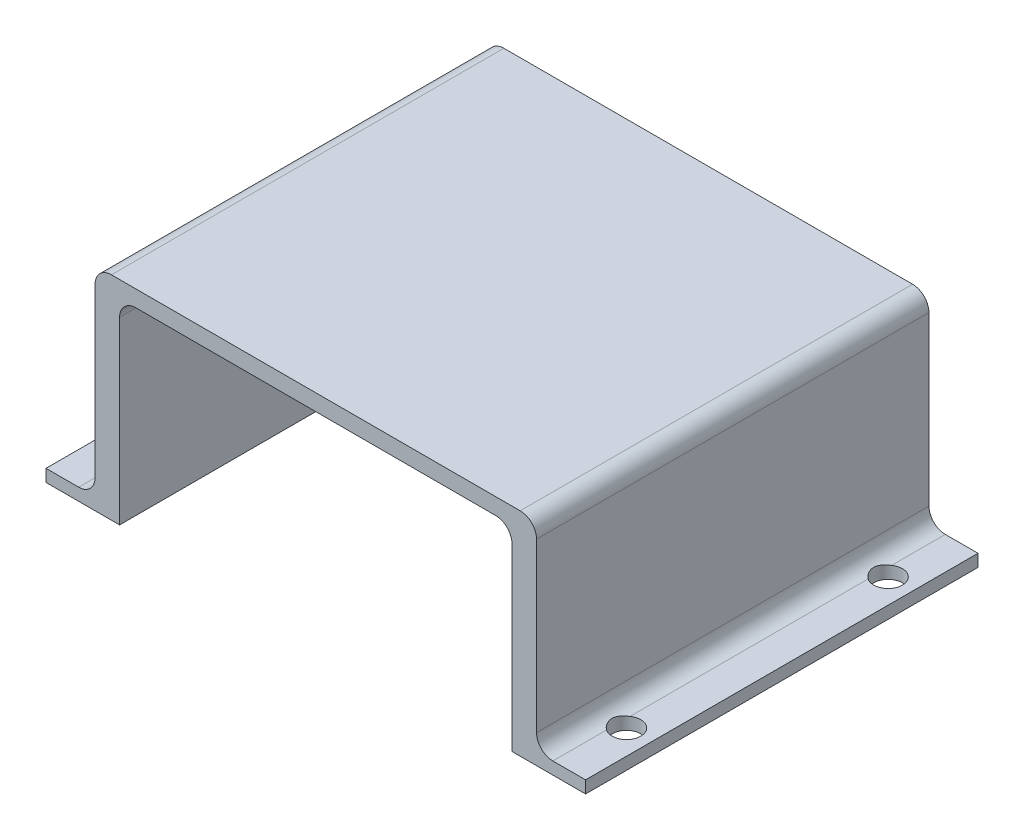
from build123d import *

# Parameters (mm, degrees)
BOSS_EXTRUDE1_DEPTH = 76.2
FILLET1_R           = 3.175
SKETCH4_R           = 2.778125
CUT_EXTRUDE1_DEPTH  = 6.35


with BuildPart() as part:
    # Sketch1 → Boss-Extrude1 (new body)
    with BuildSketch(Plane.XY):
        Polygon((0, 0), (14.2875, 0), (14.2875, 38.1), (90.4875, 38.1), (90.4875, 0), (104.775, 0), (104.775, 2.38125), (95.25, 2.38125), (95.25, 41.275), (9.525, 41.275), (9.525, 2.38125), (0, 2.38125), align=None)
    extrude(amount=BOSS_EXTRUDE1_DEPTH)

    # Fillet1
    fillet1_edges = [part.edges().sort_by_distance(p)[0] for p in [
        (9.525, 2.38125, 38.1),
        (9.525, 41.275, 38.1),
        (95.25, 41.275, 38.1),
        (95.25, 2.38125, 38.1),
        (90.4875, 38.1, 38.1),
        (14.2875, 38.1, 38.1),
    ]]
    fillet(fillet1_edges, radius=FILLET1_R)

    # Sketch4 → Cut-Extrude1 (cut, symmetric)
    with BuildSketch(Plane(origin=(0, 2.38125, 0), x_dir=(1, 0, 0), z_dir=(0, 1, 0))):
        with Locations(Location((100.0125, -12.7, 0), (0, 0, 235.150095421))):
            Circle(SKETCH4_R)
        with Locations(Location((100.0125, -63.5, 0), (0, 0, 235.150095421))):
            Circle(SKETCH4_R)
        with Locations(Location((4.7625, -63.5, 0), (0, 0, 270))):
            Circle(SKETCH4_R)
        with Locations(Location((4.7625, -12.7, 0), (0, 0, 270))):
            Circle(SKETCH4_R)
    extrude(amount=CUT_EXTRUDE1_DEPTH, both=True, mode=Mode.SUBTRACT)


solid = part.part
